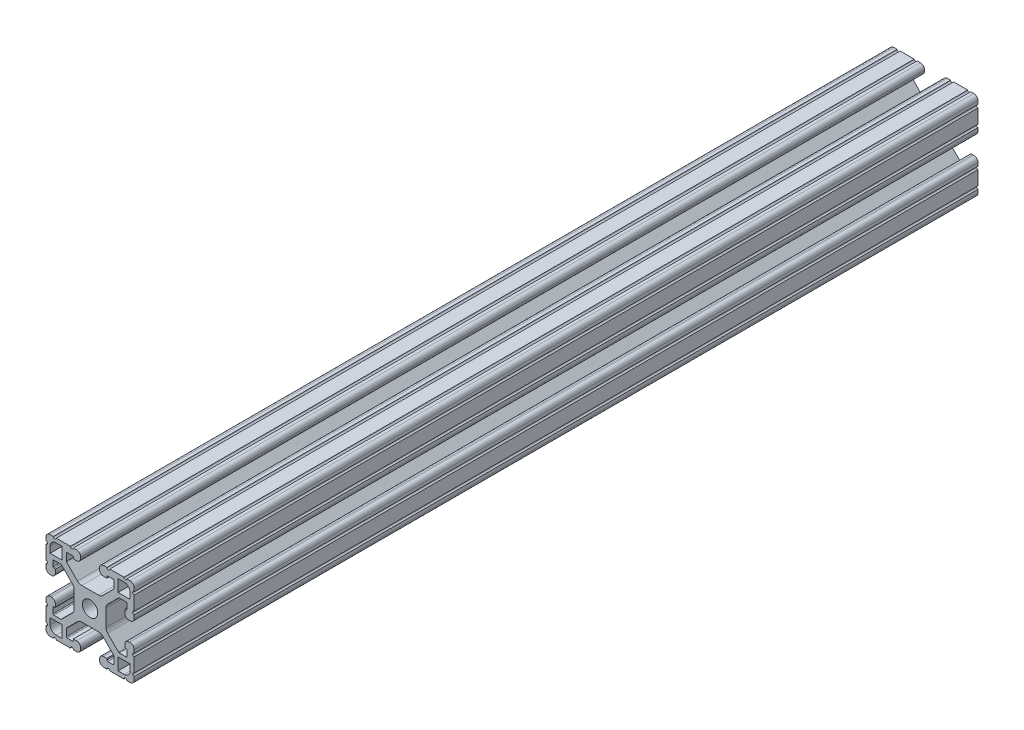
from build123d import *

# Parameters (mm, degrees)
BOSS_EXTRUDE1_DEPTH      = 457.2
BOSS_EXTRUDE1_DEPTH_BACK = 457.2
SKETCH3_W                = 38.1
SKETCH3_H                = 38.1
SKETCH4_W                = 5.207
SKETCH4_H                = 5.207
SKETCH4_R                = 3.302
CUT_EXTRUDE1_DEPTH       = 915.79678891
CUT_EXTRUDE2_DEPTH       = 915.79678891
FILLET1_R                = 2.54
FILLET2_R                = 1.778
FILLET3_R                = 0.396875
SKETCH6_W                = 42.57245352
SKETCH6_H                = 44.858703514
CUT_EXTRUDE3_DEPTH       = 549.8


with BuildPart() as part:
    # Sketch3 → Boss-Extrude1 (new, two sides: drawn at the far end of the back side and taken through both)
    with BuildSketch(Plane.XY.offset(-BOSS_EXTRUDE1_DEPTH_BACK)):
        Rectangle(SKETCH3_W, SKETCH3_H)
    extrude(amount=BOSS_EXTRUDE1_DEPTH + BOSS_EXTRUDE1_DEPTH_BACK)

    # Sketch4 → Cut-Extrude1 (cut, through all)
    with BuildSketch(Plane.XY.offset(457.2)):
        Polygon((7.239, 14.986), (4.064, 14.986), (4.064, 19.05), (-4.064, 19.05), (-4.064, 14.986), (-7.239, 14.986), (-7.239, 16.002), (-10.287, 16.002), (-10.287, 12.442261469), (-4.702738531, 6.858), (4.702738531, 6.858), (10.287, 12.442261469), (10.287, 16.002), (7.239, 16.002), align=None)
        Polygon((10.287, -12.442261469), (4.702738531, -6.858), (-4.702738531, -6.858), (-10.287, -12.442261469), (-10.287, -16.002), (-7.239, -16.002), (-7.239, -14.986), (-4.064, -14.986), (-4.064, -19.05), (4.064, -19.05), (4.064, -14.986), (7.239, -14.986), (7.239, -16.002), (10.287, -16.002), align=None)
        Polygon((-12.442261469, -10.287), (-6.858, -4.702738531), (-6.858, 4.702738531), (-12.442261469, 10.287), (-16.002, 10.287), (-16.002, 7.239), (-14.986, 7.239), (-14.986, 4.064), (-19.05, 4.064), (-19.05, -4.064), (-14.986, -4.064), (-14.986, -7.239), (-16.002, -7.239), (-16.002, -10.287), align=None)
        Polygon((14.986, -7.239), (14.986, -4.064), (19.05, -4.064), (19.05, 4.064), (14.986, 4.064), (14.986, 7.239), (16.002, 7.239), (16.002, 10.287), (12.442261469, 10.287), (6.858, 4.702738531), (6.858, -4.702738531), (12.442261469, -10.287), (16.002, -10.287), (16.002, -7.239), align=None)
        with Locations((14.6685, 14.6685)):
            Rectangle(SKETCH4_W, SKETCH4_H)
        with Locations((14.6685, -14.6685)):
            Rectangle(SKETCH4_W, SKETCH4_H)
        with Locations((-14.6685, 14.6685)):
            Rectangle(SKETCH4_W, SKETCH4_H)
        with Locations((-14.6685, -14.6685)):
            Rectangle(SKETCH4_W, SKETCH4_H)
        Circle(SKETCH4_R)
    extrude(amount=-CUT_EXTRUDE1_DEPTH, mode=Mode.SUBTRACT)

    # Sketch5 → Cut-Extrude2 (cut, through all)
    with BuildSketch(Plane.XY.offset(457.2)):
        with BuildLine():
            Line((-14.605, 19.05), (-15.875, 19.05))
            ThreePointArc((-15.875, 19.05), (-15.24, 18.415), (-14.605, 19.05))
        make_face()
        with BuildLine():
            Line((-7.239, 19.05), (-8.509, 19.05))
            ThreePointArc((-8.509, 19.05), (-7.874, 18.415), (-7.239, 19.05))
        make_face()
        with BuildLine():
            ThreePointArc((-19.05, 14.605), (-18.415, 15.24), (-19.05, 15.875))
            Line((-19.05, 15.875), (-19.05, 14.605))
        make_face()
        with BuildLine():
            ThreePointArc((-19.05, 7.239), (-18.415, 7.874), (-19.05, 8.509))
            Line((-19.05, 8.509), (-19.05, 7.239))
        make_face()
        with BuildLine():
            ThreePointArc((7.239, 19.05), (7.874, 18.415), (8.509, 19.05))
            Line((8.509, 19.05), (7.239, 19.05))
        make_face()
        with BuildLine():
            ThreePointArc((14.605, 19.05), (15.24, 18.415), (15.875, 19.05))
            Line((15.875, 19.05), (14.605, 19.05))
        make_face()
        with BuildLine():
            Line((19.05, 14.605), (19.05, 15.875))
            ThreePointArc((19.05, 15.875), (18.415, 15.24), (19.05, 14.605))
        make_face()
        with BuildLine():
            Line((19.05, 7.239), (19.05, 8.509))
            ThreePointArc((19.05, 8.509), (18.415, 7.874), (19.05, 7.239))
        make_face()
        with BuildLine():
            ThreePointArc((19.05, -7.239), (18.415, -7.874), (19.05, -8.509))
            Line((19.05, -8.509), (19.05, -7.239))
        make_face()
        with BuildLine():
            ThreePointArc((19.05, -14.605), (18.415, -15.24), (19.05, -15.875))
            Line((19.05, -15.875), (19.05, -14.605))
        make_face()
        with BuildLine():
            Line((14.605, -19.05), (15.875, -19.05))
            ThreePointArc((15.875, -19.05), (15.24, -18.415), (14.605, -19.05))
        make_face()
        with BuildLine():
            Line((7.239, -19.05), (8.509, -19.05))
            ThreePointArc((8.509, -19.05), (7.874, -18.415), (7.239, -19.05))
        make_face()
        with BuildLine():
            ThreePointArc((-7.239, -19.05), (-7.874, -18.415), (-8.509, -19.05))
            Line((-8.509, -19.05), (-7.239, -19.05))
        make_face()
        with BuildLine():
            ThreePointArc((-14.605, -19.05), (-15.24, -18.415), (-15.875, -19.05))
            Line((-15.875, -19.05), (-14.605, -19.05))
        make_face()
        with BuildLine():
            Line((-19.05, -14.605), (-19.05, -15.875))
            ThreePointArc((-19.05, -15.875), (-18.415, -15.24), (-19.05, -14.605))
        make_face()
        with BuildLine():
            Line((-19.05, -7.239), (-19.05, -8.509))
            ThreePointArc((-19.05, -8.509), (-18.415, -7.874), (-19.05, -7.239))
        make_face()
    extrude(amount=-CUT_EXTRUDE2_DEPTH, mode=Mode.SUBTRACT)

    # Fillet1
    fillet1_edges = [part.edges().sort_by_distance(p)[0] for p in [
        (6.858, -4.702738531, 0),
        (6.858, 4.702738531, 0),
        (-17.272, 17.272, 0),
        (-17.272, -17.272, 0),
        (17.272, -17.272, 0),
        (17.272, 17.272, 0),
        (-4.702738531, -6.858, 0),
        (4.702738531, -6.858, 0),
        (-6.858, 4.702738531, 0),
        (-6.858, -4.702738531, 0),
        (4.702738531, 6.858, 0),
        (-4.702738531, 6.858, 0),
    ]]
    fillet(fillet1_edges, radius=FILLET1_R)

    # Fillet2
    fillet2_edges = [part.edges().sort_by_distance(p)[0] for p in [
        (14.986, 4.064, 0),
        (19.05, 4.064, 0),
        (19.05, -4.064, 0),
        (14.986, -4.064, 0),
        (4.064, -14.986, 0),
        (4.064, -19.05, 0),
        (-4.064, -19.05, 0),
        (-4.064, -14.986, 0),
        (-14.986, -4.064, 0),
        (-19.05, -4.064, 0),
        (-19.05, 4.064, 0),
        (-14.986, 4.064, 0),
        (-19.05, 19.05, 0),
        (19.05, 19.05, 0),
        (19.05, -19.05, 0),
        (-19.05, -19.05, 0),
        (-4.064, 14.986, 0),
        (-4.064, 19.05, 0),
        (4.064, 19.05, 0),
        (4.064, 14.986, 0),
    ]]
    fillet(fillet2_edges, radius=FILLET2_R)

    # Fillet3
    fillet3_edges = [part.edges().sort_by_distance(p)[0] for p in [
        (12.442261469, 10.287, 0),
        (16.002, 10.287, 0),
        (16.002, 7.239, 0),
        (16.002, -7.239, 0),
        (16.002, -10.287, 0),
        (12.442261469, -10.287, 0),
        (-7.239, -16.002, 0),
        (-10.287, -16.002, 0),
        (-10.287, -12.442261469, 0),
        (10.287, -12.442261469, 0),
        (10.287, -16.002, 0),
        (7.239, -16.002, 0),
        (-16.002, 7.239, 0),
        (-16.002, 10.287, 0),
        (-12.442261469, 10.287, 0),
        (-12.442261469, -10.287, 0),
        (-16.002, -10.287, 0),
        (-14.986, -7.239, 0),
        (-10.287, 12.442261469, 0),
        (-10.287, 16.002, 0),
        (-7.239, 16.002, 0),
        (7.239, 16.002, 0),
        (10.287, 16.002, 0),
        (10.287, 12.442261469, 0),
    ]]
    fillet(fillet3_edges, radius=FILLET3_R)

    # Sketch6 → Cut-Extrude3 (cut)
    with BuildSketch(Plane.XY.offset(457.2)):
        Rectangle(SKETCH6_W, SKETCH6_H)
    extrude(amount=-CUT_EXTRUDE3_DEPTH, mode=Mode.SUBTRACT)


solid = part.part
